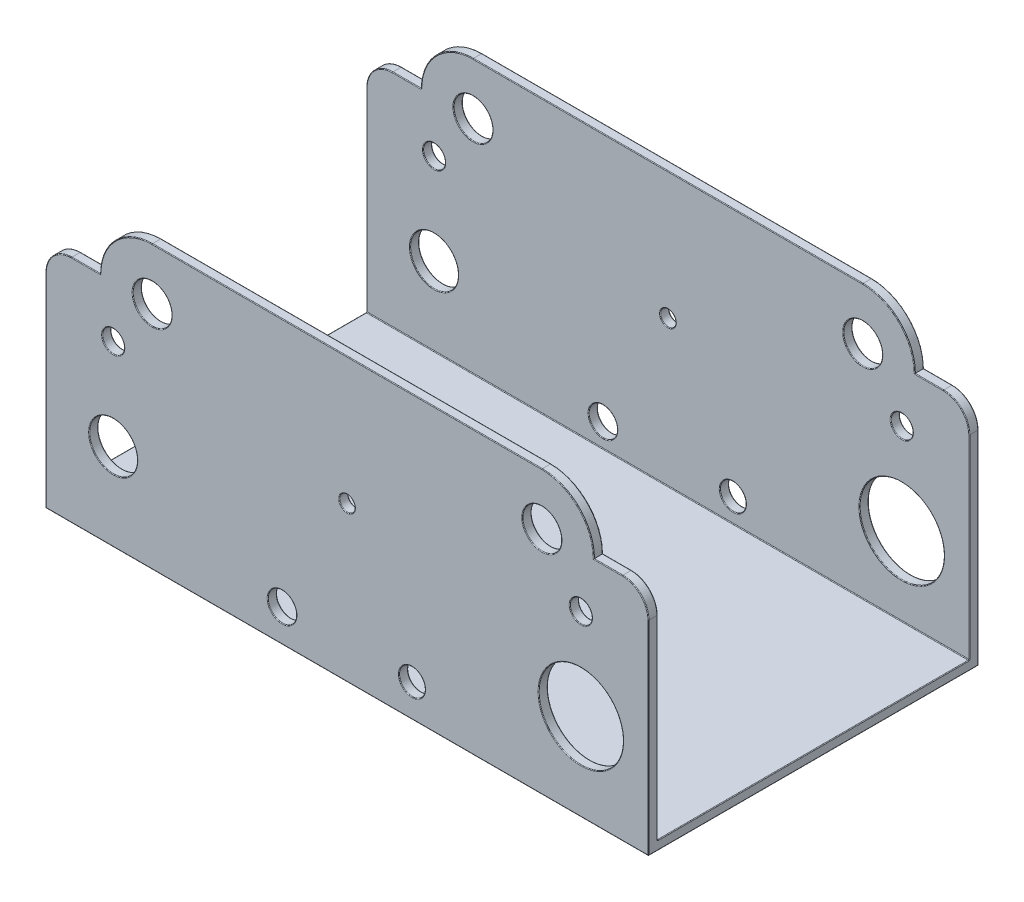
from build123d import *

# Parameters (mm, degrees)
SKETCH_1_W          = 464
SKETCH_1_H          = 254
EXTRUDE_1_DEPTH     = 7
SKETCH_2_W          = 464
SKETCH_2_H          = 7
EXTRUDE_2_DEPTH     = 210
SKETCH_4_R          = 18.5
SKETCH_4_R_2        = 8.5
SKETCH_4_R_3        = 15
SKETCH_4_R_4        = 32.5
CUT_EXTRUDE_1_DEPTH = 407.729639933
SKETCH_6_R          = 11
SKETCH_6_R_2        = 10
SKETCH_6_R_3        = 6
CUT_EXTRUDE_2_DEPTH = 407.729639933
CUT_EXTRUDE_3_DEPTH = 407.729639933
FILLET_1_R          = 20
FILLET_2_R          = 20
FILLET_3_R          = 20
FILLET_4_R          = 20
FILLET_5_R          = 0.5


with BuildPart() as part:
    # 草图1 → 凸台-拉伸1 (new body)
    with BuildSketch(Plane(origin=(0, 0, 0), x_dir=(1, 0, 0), z_dir=(0, 1, 0))):
        Rectangle(SKETCH_1_W, SKETCH_1_H)
    extrude(amount=EXTRUDE_1_DEPTH)

    # 草图2 → 凸台-拉伸2 (add)
    with BuildSketch(Plane(origin=(0, 7, 0), x_dir=(1, 0, 0), z_dir=(0, 1, 0))):
        with Locations((0, 123.5)):
            Rectangle(SKETCH_2_W, SKETCH_2_H)
        with Locations((0, -123.5)):
            Rectangle(SKETCH_2_W, SKETCH_2_H)
    extrude(amount=EXTRUDE_2_DEPTH)

    # 草图4 → 切除-拉伸1 (cut, through all)
    with BuildSketch(Plane.XY.offset(127)):
        with Locations((-180, 67)):
            Circle(SKETCH_4_R)
        with Locations((-180, 137)):
            Circle(SKETCH_4_R_2)
        with Locations((180, 137)):
            Circle(SKETCH_4_R_2)
        with Locations((-150, 177)):
            Circle(SKETCH_4_R_3)
        with Locations((150, 177)):
            Circle(SKETCH_4_R_3)
        with Locations((180, 67)):
            Circle(SKETCH_4_R_4)
    extrude(amount=-CUT_EXTRUDE_1_DEPTH, mode=Mode.SUBTRACT)

    # 草图6 → 切除-拉伸2 (cut, through all)
    with BuildSketch(Plane.XY.offset(127)):
        with Locations((-50, 25.075)):
            Circle(SKETCH_6_R)
        with Locations((50, 25.075)):
            Circle(SKETCH_6_R_2)
        with Locations((0, 119)):
            Circle(SKETCH_6_R_3)
    extrude(amount=-CUT_EXTRUDE_2_DEPTH, mode=Mode.SUBTRACT)

    # 草图7 → 切除-拉伸3 (cut, through all)
    with BuildSketch(Plane(origin=(0, 0, -127), x_dir=(-1, 0, 0), z_dir=(0, 0, -1))):
        with BuildLine():
            Line((-232, 217), (-232, 177))
            Line((-232, 177), (-190, 177))
            ThreePointArc((-190, 177), (-178.284271247, 205.284271247), (-150, 217))
            Line((-150, 217), (-232, 217))
        make_face()
        with BuildLine():
            Line((190, 177), (232, 177))
            Line((232, 177), (232, 217))
            Line((232, 217), (150, 217))
            ThreePointArc((150, 217), (178.284271247, 205.284271247), (190, 177))
        make_face()
    extrude(amount=-CUT_EXTRUDE_3_DEPTH, mode=Mode.SUBTRACT)

    # 圆角1
    fillet_1_edges = [part.edges().sort_by_distance(p)[0] for p in [
        (232, 177, 123.5),
    ]]
    fillet(fillet_1_edges, radius=FILLET_1_R)

    # 圆角2
    fillet_2_edges = [part.edges().sort_by_distance(p)[0] for p in [
        (232, 177, -123.5),
    ]]
    fillet(fillet_2_edges, radius=FILLET_2_R)

    # 圆角3
    fillet_3_edges = [part.edges().sort_by_distance(p)[0] for p in [
        (-232, 177, 123.5),
    ]]
    fillet(fillet_3_edges, radius=FILLET_3_R)

    # 圆角4
    fillet_4_edges = [part.edges().sort_by_distance(p)[0] for p in [
        (-232, 177, -123.5),
    ]]
    fillet(fillet_4_edges, radius=FILLET_4_R)

    # 圆角5
    fillet_5_edges = [part.edges().sort_by_distance(p)[0] for p in [
        (40, 25.075, -127),
        (40, 25.075, -120),
        (40, 25.075, 120),
        (40, 25.075, 127),
        (-6, 119, -127),
        (-6, 119, -120),
        (-6, 119, 120),
        (-6, 119, 127),
        (178.284271247, 205.284271247, -120),
        (178.284271247, 205.284271247, 120),
        (178.284271247, 205.284271247, 127),
        (178.284271247, 205.284271247, -127),
        (-232, 7, 0),
        (0, 217, 120),
        (0, 217, 127),
        (-201, 177, 120),
        (0, 217, -127),
        (0, 217, -120),
        (0, 7, -120),
        (-201, 177, -120),
        (-178.284271247, 205.284271247, -120),
        (-178.284271247, 205.284271247, 120),
        (-178.284271247, 205.284271247, 127),
        (-201, 177, 127),
        (-178.284271247, 205.284271247, -127),
        (-201, 177, -127),
        (201, 177, 120),
        (201, 177, 127),
        (232, 82, 120),
        (226.142135624, 171.142135624, 120),
        (232, 78.5, 127),
        (226.142135624, 171.142135624, 127),
        (201, 177, -127),
        (201, 177, -120),
        (232, 78.5, -127),
        (232, 82, -120),
        (226.142135624, 171.142135624, -120),
        (226.142135624, 171.142135624, -127),
        (-232, 82, 120),
        (-226.142135624, 171.142135624, 120),
        (-232, 78.5, 127),
        (-226.142135624, 171.142135624, 127),
        (-232, 82, -120),
        (-232, 78.5, -127),
        (-226.142135624, 171.142135624, -127),
        (-226.142135624, 171.142135624, -120),
        (232, 7, 0),
        (0, 7, 120),
        (-198.5, 67, -127),
        (-198.5, 67, -120),
        (-198.5, 67, 120),
        (-198.5, 67, 127),
        (0, 0, -127),
        (232, 0, 0),
        (0, 0, 127),
        (-232, 0, 0),
        (147.5, 67, -127),
        (147.5, 67, -120),
        (147.5, 67, 120),
        (147.5, 67, 127),
        (135, 177, -127),
        (135, 177, -120),
        (135, 177, 120),
        (135, 177, 127),
        (-165, 177, -127),
        (-165, 177, -120),
        (-165, 177, 120),
        (-165, 177, 127),
        (171.5, 137, -127),
        (171.5, 137, -120),
        (171.5, 137, 120),
        (171.5, 137, 127),
        (-188.5, 137, -127),
        (-188.5, 137, -120),
        (-188.5, 137, 120),
        (-188.5, 137, 127),
        (-61, 25.075, -127),
        (-61, 25.075, -120),
        (-61, 25.075, 120),
        (-61, 25.075, 127),
    ]]
    fillet(fillet_5_edges, radius=FILLET_5_R)


solid = part.part
